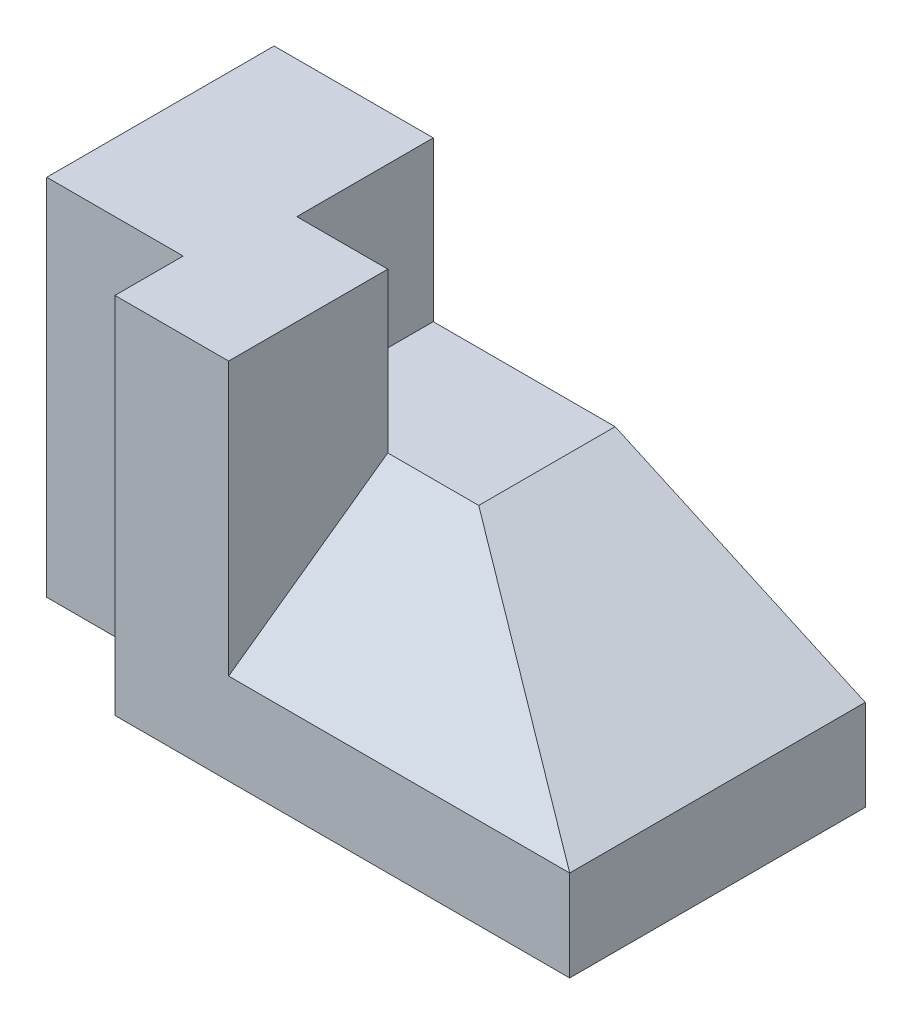
from build123d import *

# Parameters (mm, degrees)
SKETCH1_W           = 30
SKETCH1_H           = 80
BOSS_EXTRUDE1_DEPTH = 50
BOSS_EXTRUDE2_DEPTH = 15
BOSS_EXTRUDE3_DEPTH = 20
SKETCH2_W           = 25
SKETCH2_H           = 45
BOSS_EXTRUDE4_DEPTH = 30
SKETCH3_W           = 75
SKETCH3_H           = 25
BOSS_EXTRUDE7_DEPTH = 65
SKETCH7_W           = 75
SKETCH7_H           = 20
BOSS_EXTRUDE8_DEPTH = 30
CUT_EXTRUDE6_DEPTH  = 144.614066163
CUT_EXTRUDE7_DEPTH  = 75
SKETCH11_W          = 5
SKETCH11_H          = 35
BOSS_EXTRUDE9_DEPTH = 30


with BuildPart() as part:
    # Sketch1 → Boss-Extrude1 (new body)
    with BuildSketch(Plane.XY):
        with Locations((-15, 40)):
            Rectangle(SKETCH1_W, SKETCH1_H)
    extrude(amount=-BOSS_EXTRUDE1_DEPTH)



with BuildPart() as body_2:
    # Sketch1<3> → Boss-Extrude2 (new body)
    with BuildSketch(Plane.XY):
        Polygon((0, 80), (0, 0), (100, 0), (100, 20), (25, 20), (25, 80), align=None)
    extrude(amount=BOSS_EXTRUDE2_DEPTH)


with BuildPart() as part_1:
    add(part.part)

    add(body_2.part)  # Boss-Extrude3 merges body 2
    # Sketch1<4> → Boss-Extrude3 (add)
    with BuildSketch(Plane.XY):
        Polygon((0, 80), (0, 0), (100, 0), (100, 20), (25, 20), (25, 80), align=None)
    extrude(amount=-BOSS_EXTRUDE3_DEPTH)

    # Sketch2 → Boss-Extrude4 (add)
    with BuildSketch(Plane(origin=(0, 0, -20), x_dir=(-1, 0, 0), z_dir=(0, 0, -1))):
        with Locations((-12.5, 22.5)):
            Rectangle(SKETCH2_W, SKETCH2_H)
    extrude(amount=BOSS_EXTRUDE4_DEPTH)

    # Sketch3 → Boss-Extrude7 (add)
    with BuildSketch(Plane.XY.offset(15)):
        with Locations((62.5, 32.5)):
            Rectangle(SKETCH3_W, SKETCH3_H)
    extrude(amount=-BOSS_EXTRUDE7_DEPTH)

    # Sketch7 → Boss-Extrude8 (add)
    with BuildSketch(Plane(origin=(0, 0, -20), x_dir=(-1, 0, 0), z_dir=(0, 0, -1))):
        with Locations((-62.5, 10)):
            Rectangle(SKETCH7_W, SKETCH7_H)
    extrude(amount=BOSS_EXTRUDE8_DEPTH)

    # Sketch8 → Cut-Extrude6 (cut, through all)
    with BuildSketch(Plane.XY.offset(15)):
        Polygon((100, 45), (100, 20), (45, 45), align=None)
    extrude(amount=-CUT_EXTRUDE6_DEPTH, mode=Mode.SUBTRACT)

    # Sketch9 → Cut-Extrude7 (cut)
    with BuildSketch(Plane(origin=(100, 0, 0), x_dir=(0, 0, -1), z_dir=(1, 0, 0))):
        Polygon((-15, 45), (20, 45), (-15, 20), align=None)
    extrude(amount=-CUT_EXTRUDE7_DEPTH, mode=Mode.SUBTRACT)

    # Sketch11 → Boss-Extrude9 (add)
    with BuildSketch(Plane(origin=(0, 0, -20), x_dir=(-1, 0, 0), z_dir=(0, 0, -1))):
        with Locations((-2.5, 62.5)):
            Rectangle(SKETCH11_W, SKETCH11_H)
    extrude(amount=BOSS_EXTRUDE9_DEPTH)


solid = part_1.part
